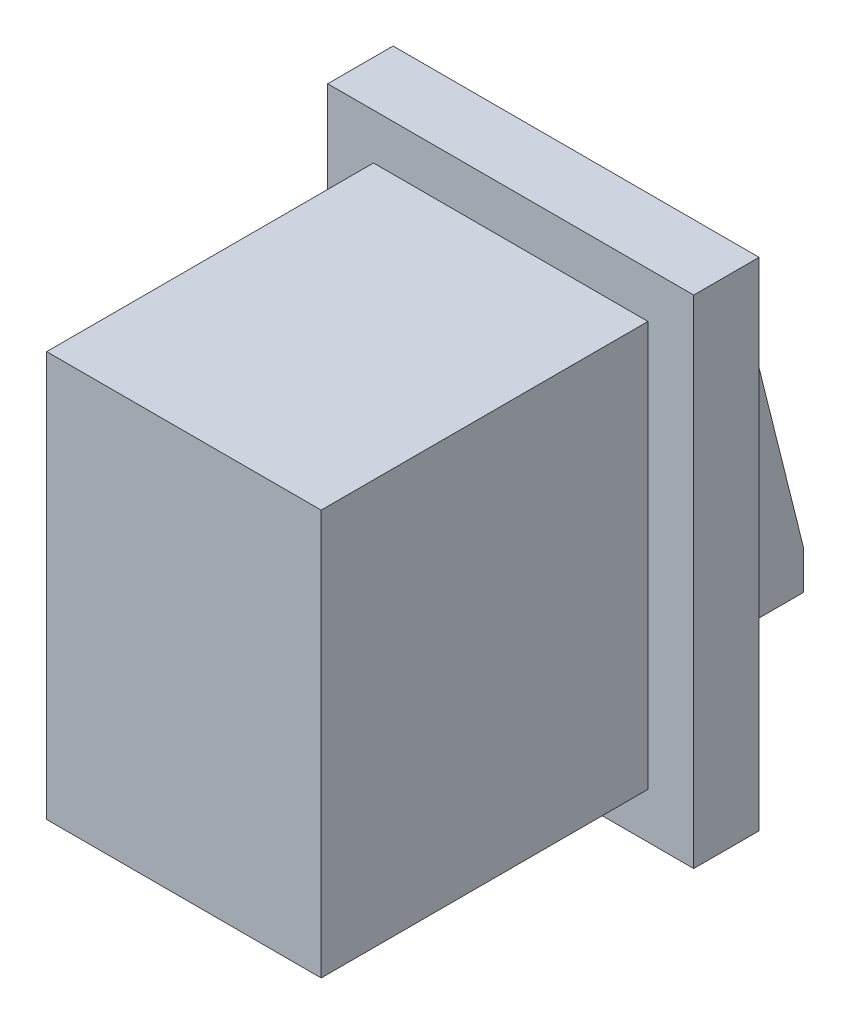
from build123d import *

# Parameters (mm, degrees)
SKETCH1_W           = 21
SKETCH1_H           = 31
BOSS_EXTRUDE1_DEPTH = 25
SKETCH2_W           = 28
SKETCH2_H           = 38
BOSS_EXTRUDE2_DEPTH = 5
SKETCH3_W           = 14.768534612
SKETCH3_H           = 23.038215668
BOSS_EXTRUDE3_DEPTH = 10
CHAMFER1_SIZE       = 5
CHAMFER1_SIZE2      = 20


with BuildPart() as part:
    # Sketch1 → Boss-Extrude1 (new body)
    with BuildSketch(Plane.XY):
        Rectangle(SKETCH1_W, SKETCH1_H)
    extrude(amount=BOSS_EXTRUDE1_DEPTH)

    # Sketch2 → Boss-Extrude2 (add)
    with BuildSketch(Plane(origin=(0, 0, 0), x_dir=(-1, 0, 0), z_dir=(0, 0, -1))):
        Rectangle(SKETCH2_W, SKETCH2_H)
    extrude(amount=BOSS_EXTRUDE2_DEPTH)

    # Sketch3 → Boss-Extrude3 (add)
    with BuildSketch(Plane(origin=(0, 0, -5), x_dir=(-1, 0, 0), z_dir=(0, 0, -1))):
        Rectangle(SKETCH3_W, SKETCH3_H)
    extrude(amount=BOSS_EXTRUDE3_DEPTH)

    # Chamfer1
    chamfer1_edges = [part.edges().sort_by_distance(p)[0] for p in [
        (0, 11.519107834, -15),
    ]]
    chamfer1_side = [part.faces().sort_by_distance(p)[0] for p in [
        (0, 11.519107834, -10),
    ]]
    chamfer(chamfer1_edges, length=CHAMFER1_SIZE, length2=CHAMFER1_SIZE2, reference=chamfer1_side[0])


solid = part.part
